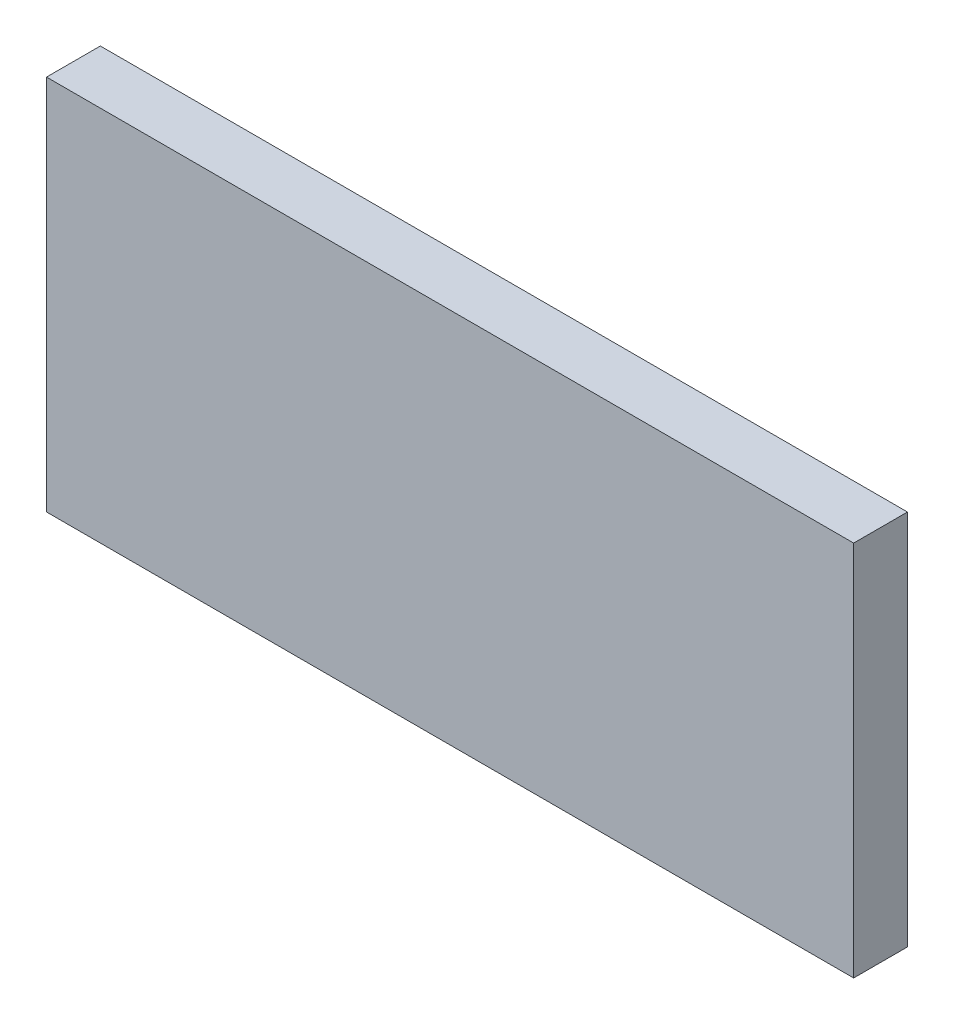
from build123d import *

# Parameters (mm, degrees)
ESQUISSE1_W        = 150
ESQUISSE1_H        = 70
BOSS_EXTRU_1_DEPTH = 10


with BuildPart() as part:
    # Esquisse1 → Boss.-Extru.1 (new body)
    with BuildSketch(Plane.XY):
        with Locations((75, 35)):
            Rectangle(ESQUISSE1_W, ESQUISSE1_H)
    extrude(amount=BOSS_EXTRU_1_DEPTH)


solid = part.part
